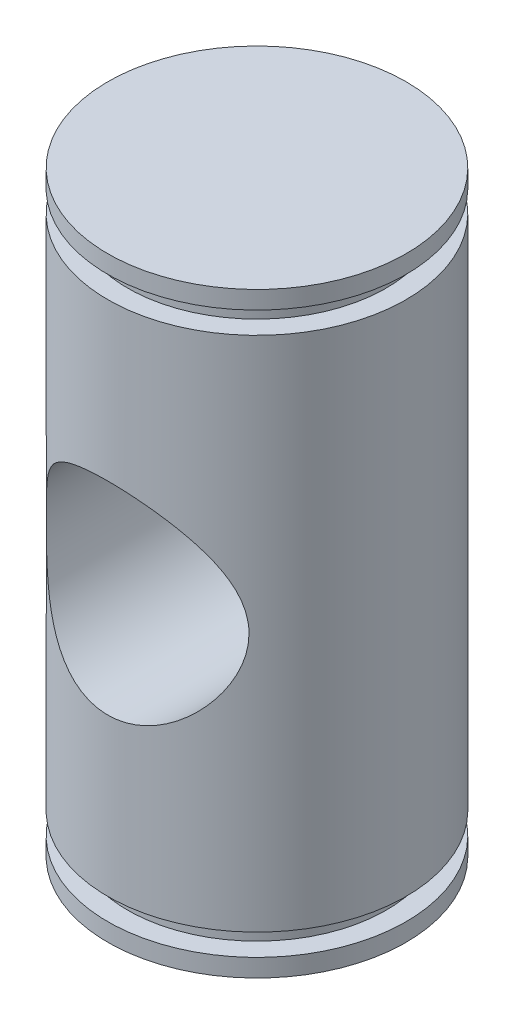
from build123d import *

# Parameters (mm, degrees)
SKETCH1_R               = 7.5
BOSS_EXTRUDE1_DEPTH     = 24
CUT_EXTRUDE1_DEPTH      = 27.239283527
CUT_EXTRUDE1_DEPTH_BACK = 27.239283527
SKETCH2_R               = 5.1


with BuildPart() as part:
    # Sketch1 → Boss-Extrude1 (new body)
    with BuildSketch(Plane(origin=(0, 0, 0), x_dir=(1, 0, 0), z_dir=(0, 1, 0))):
        with Locations(Location((0, 0, 0), (0, 0, 270))):
            Circle(SKETCH1_R)
    extrude(amount=BOSS_EXTRUDE1_DEPTH)

    # Sketch2 → Cut-Extrude1 (cut, two sides: drawn at the far end of the back side and taken through both)
    with BuildSketch(Plane.XY.offset(-CUT_EXTRUDE1_DEPTH_BACK)):
        with Locations(Location((0, 12, 0), (0, 0, 90.000000001))):
            Circle(SKETCH2_R)
    extrude(amount=CUT_EXTRUDE1_DEPTH + CUT_EXTRUDE1_DEPTH_BACK, mode=Mode.SUBTRACT)

    # Sketch3 → Revolve1 (revolve)
    with BuildSketch(Plane.XY, mode=Mode.PRIVATE) as revolve1_sk:
        Polygon((0, 24), (-7.5, 24), (-7.5, 25), (-6.5, 25), (-6.5, 26.1), (-7.5, 26.1), (-7.5, 27), (0, 27), align=None)
        Polygon((-7.5, -3), (0, -3), (0, 0), (-7.5, 0), (-7.5, -1), (-6.5, -1), (-6.5, -2.1), (-7.5, -2.1), align=None)
    revolve(revolve1_sk.sketch.rotate(Axis((0, 0, 0), (0, 1, 0)), 270), axis=Axis((0, 0, 0), (0, 1, 0)))


solid = part.part
